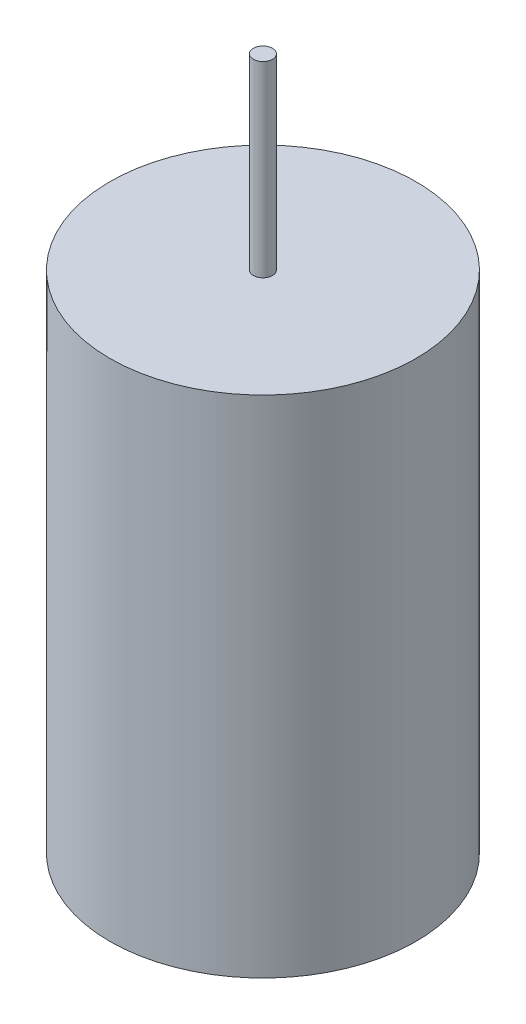
from build123d import *

# Parameters (mm, degrees)
SKETCH1_R           = 18.8
BOSS_EXTRUDE1_DEPTH = 62
SKETCH2_R           = 1.17
BOSS_EXTRUDE2_DEPTH = 23


with BuildPart() as part:
    # Sketch1 → Boss-Extrude1 (new body)
    with BuildSketch(Plane(origin=(0, 0, 0), x_dir=(1, 0, 0), z_dir=(0, 1, 0))):
        with Locations(Location((0, 0, 0), (0, 0, 270))):
            Circle(SKETCH1_R)
    extrude(amount=-BOSS_EXTRUDE1_DEPTH)

    # Sketch2 → Boss-Extrude2 (add)
    with BuildSketch(Plane(origin=(0, 0, 0), x_dir=(1, 0, 0), z_dir=(0, 1, 0))):
        with Locations(Location((0, 0, 0), (0, 0, 270))):
            Circle(SKETCH2_R)
    extrude(amount=BOSS_EXTRUDE2_DEPTH)


solid = part.part
